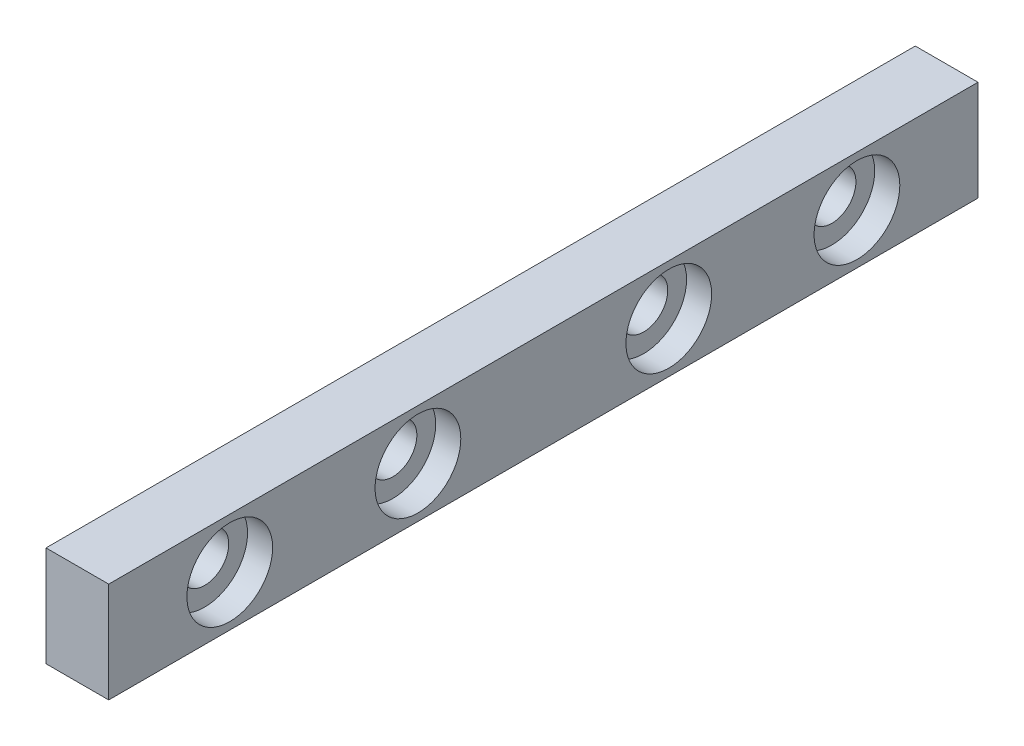
from build123d import *

# Parameters (mm, degrees)
SKETCH_1_W          = 41.58
SKETCH_1_H          = 4.8
SKETCH_1_R          = 1.15
EXTRUDE_1_DEPTH     = 3
SKETCH_2_R          = 2.05
CUT_EXTRUDE_1_DEPTH = 1.2


with BuildPart() as part:
    # 草图1 → 凸台-拉伸1 (new body)
    with BuildSketch(Plane(origin=(0, 0, 0), x_dir=(0, 0, -1), z_dir=(1, 0, 0))):
        with Locations((20.79, 2.4)):
            Rectangle(SKETCH_1_W, SKETCH_1_H)
        with Locations((14.79, 2.4)):
            Circle(SKETCH_1_R, mode=Mode.SUBTRACT)
        with Locations((5.79, 2.4)):
            Circle(SKETCH_1_R, mode=Mode.SUBTRACT)
        with Locations(Location((26.79, 2.4, 0), (0, 0, 180))):
            Circle(SKETCH_1_R, mode=Mode.SUBTRACT)
        with Locations(Location((35.79, 2.4, 0), (0, 0, 180))):
            Circle(SKETCH_1_R, mode=Mode.SUBTRACT)
    extrude(amount=EXTRUDE_1_DEPTH)

    # 草图2 → 切除-拉伸1 (cut)
    with BuildSketch(Plane(origin=(3, 0, 0), x_dir=(0, 0, -1), z_dir=(1, 0, 0))):
        with Locations((5.79, 2.4)):
            Circle(SKETCH_2_R)
        with Locations((14.79, 2.4)):
            Circle(SKETCH_2_R)
        with Locations((26.79, 2.4)):
            Circle(SKETCH_2_R)
        with Locations((35.79, 2.4)):
            Circle(SKETCH_2_R)
    extrude(amount=-CUT_EXTRUDE_1_DEPTH, mode=Mode.SUBTRACT)


solid = part.part
